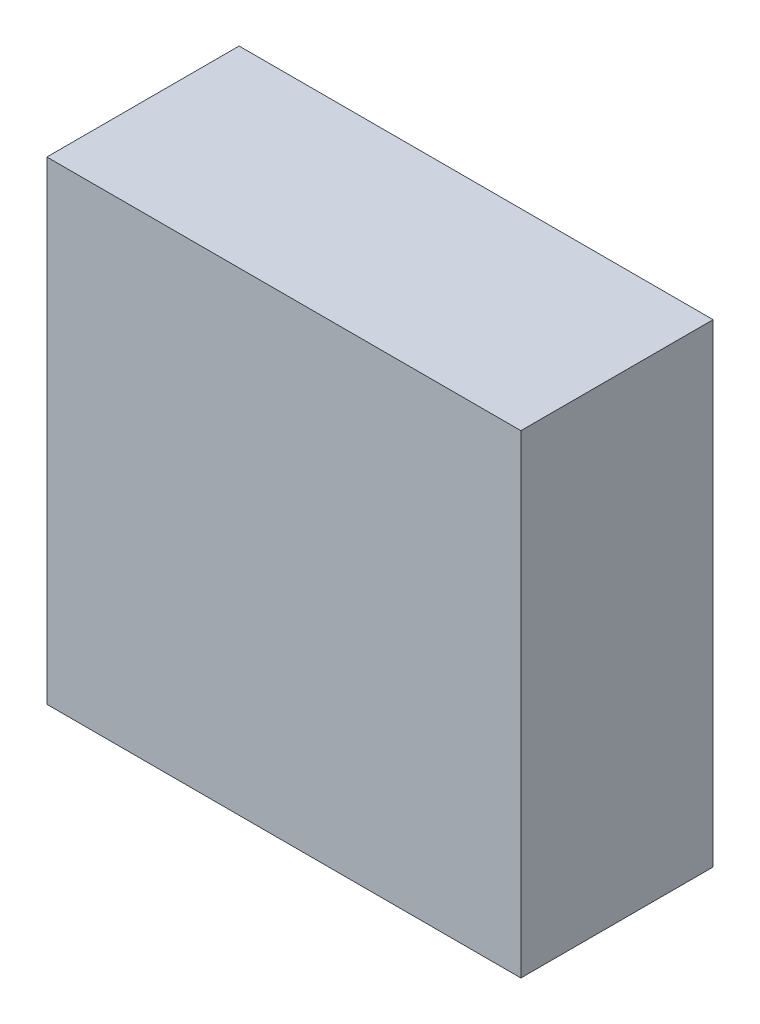
from build123d import *

# Parameters (mm, degrees)
SKETCH1_W           = 45
SKETCH1_H           = 45
BOSS_EXTRUDE1_DEPTH = 18.25


with BuildPart() as part:
    # Sketch1 → Boss-Extrude1 (new body)
    with BuildSketch(Plane.XY):
        with Locations((22.5, -22.5)):
            Rectangle(SKETCH1_W, SKETCH1_H)
    extrude(amount=BOSS_EXTRUDE1_DEPTH)


solid = part.part
